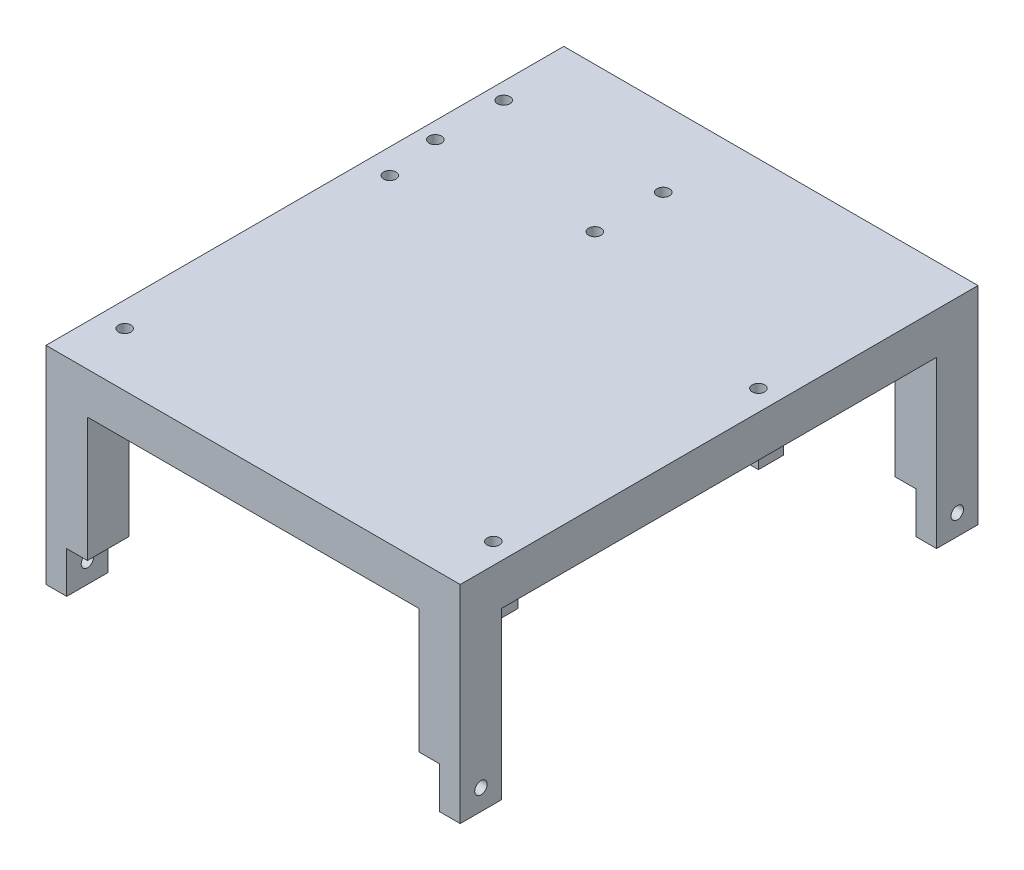
from build123d import *

# Parameters (mm, degrees)
SKETCH2_W           = 100
SKETCH2_H           = 80
BOSS_EXTRUDE1_DEPTH = 10
SKETCH3_W           = 10
SKETCH3_H           = 10
BOSS_EXTRUDE2_DEPTH = 30
SKETCH4_W           = 5
SKETCH4_H           = 10
BOSS_EXTRUDE3_DEPTH = 10
SKETCH5_W           = 6
SKETCH5_H           = 6
BOSS_EXTRUDE4_DEPTH = 4
SKETCH6_R           = 1.5
CUT_EXTRUDE1_DEPTH  = 134.026313187
SKETCH7_W           = 100
SKETCH7_H           = 10
BOSS_EXTRUDE5_DEPTH = 45
SKETCH8_W           = 10
SKETCH8_H           = 10
BOSS_EXTRUDE6_DEPTH = 30
SKETCH9_W           = 5
SKETCH9_H           = 10
BOSS_EXTRUDE7_DEPTH = 10
SKETCH10_R          = 1.5
CUT_EXTRUDE2_DEPTH  = 166
SKETCH11_R          = 1.5
CUT_EXTRUDE3_DEPTH  = 10


with BuildPart() as part:
    # Sketch2 → Boss-Extrude1 (new body)
    with BuildSketch(Plane(origin=(0, 0, 0), x_dir=(1, 0, 0), z_dir=(0, 1, 0))):
        with Locations((50, 40)):
            Rectangle(SKETCH2_W, SKETCH2_H)
    extrude(amount=BOSS_EXTRUDE1_DEPTH)

    # Sketch3 → Boss-Extrude2 (add)
    with BuildSketch(Plane.XZ):
        with Locations((95, -5)):
            Rectangle(SKETCH3_W, SKETCH3_H)
        with Locations((5, -5)):
            Rectangle(SKETCH3_W, SKETCH3_H)
    extrude(amount=BOSS_EXTRUDE2_DEPTH)

    # Sketch4 → Boss-Extrude3 (add)
    with BuildSketch(Plane.XZ.offset(30)):
        with Locations((2.5, -5)):
            Rectangle(SKETCH4_W, SKETCH4_H)
        with Locations((97.5, -5)):
            Rectangle(SKETCH4_W, SKETCH4_H)
    extrude(amount=BOSS_EXTRUDE3_DEPTH)

    # Sketch5 → Boss-Extrude4 (add)
    with BuildSketch(Plane.XZ):
        with Locations((6, -13)):
            Rectangle(SKETCH5_W, SKETCH5_H)
        with Locations((95, -13)):
            Rectangle(SKETCH5_W, SKETCH5_H)
        with Locations((95, -77)):
            Rectangle(SKETCH5_W, SKETCH5_H)
        with Locations((6, -77)):
            Rectangle(SKETCH5_W, SKETCH5_H)
    extrude(amount=BOSS_EXTRUDE4_DEPTH)

    # Sketch6 → Cut-Extrude1 (cut, through all)
    with BuildSketch(Plane.XZ.offset(4)):
        with Locations(Location((6, -13, 0), (0, 0, 270))):
            Circle(SKETCH6_R)
        with Locations(Location((95, -13, 0), (0, 0, 270))):
            Circle(SKETCH6_R)
        with Locations(Location((95, -77, 0), (0, 0, 270))):
            Circle(SKETCH6_R)
        with Locations(Location((6, -77, 0), (0, 0, 270))):
            Circle(SKETCH6_R)
    extrude(amount=-CUT_EXTRUDE1_DEPTH, mode=Mode.SUBTRACT)

    # Sketch7 → Boss-Extrude5 (add)
    with BuildSketch(Plane(origin=(0, 0, -80), x_dir=(-1, 0, 0), z_dir=(0, 0, -1))):
        with Locations((-50, 5)):
            Rectangle(SKETCH7_W, SKETCH7_H)
    extrude(amount=BOSS_EXTRUDE5_DEPTH)

    # Sketch8 → Boss-Extrude6 (add)
    with BuildSketch(Plane.XZ):
        with Locations((5, -120)):
            Rectangle(SKETCH8_W, SKETCH8_H)
        with Locations((95, -120)):
            Rectangle(SKETCH8_W, SKETCH8_H)
    extrude(amount=BOSS_EXTRUDE6_DEPTH)

    # Sketch9 → Boss-Extrude7 (add)
    with BuildSketch(Plane.XZ.offset(30)):
        with Locations((2.5, -120)):
            Rectangle(SKETCH9_W, SKETCH9_H)
        with Locations((97.5, -120)):
            Rectangle(SKETCH9_W, SKETCH9_H)
    extrude(amount=BOSS_EXTRUDE7_DEPTH)

    # Sketch10 → Cut-Extrude2 (cut, through all)
    with BuildSketch(Plane.ZY):
        with Locations((-5, -35)):
            Circle(SKETCH10_R)
        with Locations((-120, -35)):
            Circle(SKETCH10_R)
    extrude(amount=-CUT_EXTRUDE2_DEPTH, mode=Mode.SUBTRACT)

    # Sketch11 → Cut-Extrude3 (cut)
    with BuildSketch(Plane.XZ):
        with Locations(Location((4, -106.5, 0), (0, 0, 270))):
            Circle(SKETCH11_R)
        with Locations(Location((4, -90, 0), (0, 0, 270))):
            Circle(SKETCH11_R)
        with Locations(Location((42.5, -106.5, 0), (0, 0, 270))):
            Circle(SKETCH11_R)
        with Locations(Location((42.5, -90, 0), (0, 0, 270))):
            Circle(SKETCH11_R)
    extrude(amount=-CUT_EXTRUDE3_DEPTH, mode=Mode.SUBTRACT)


solid = part.part
